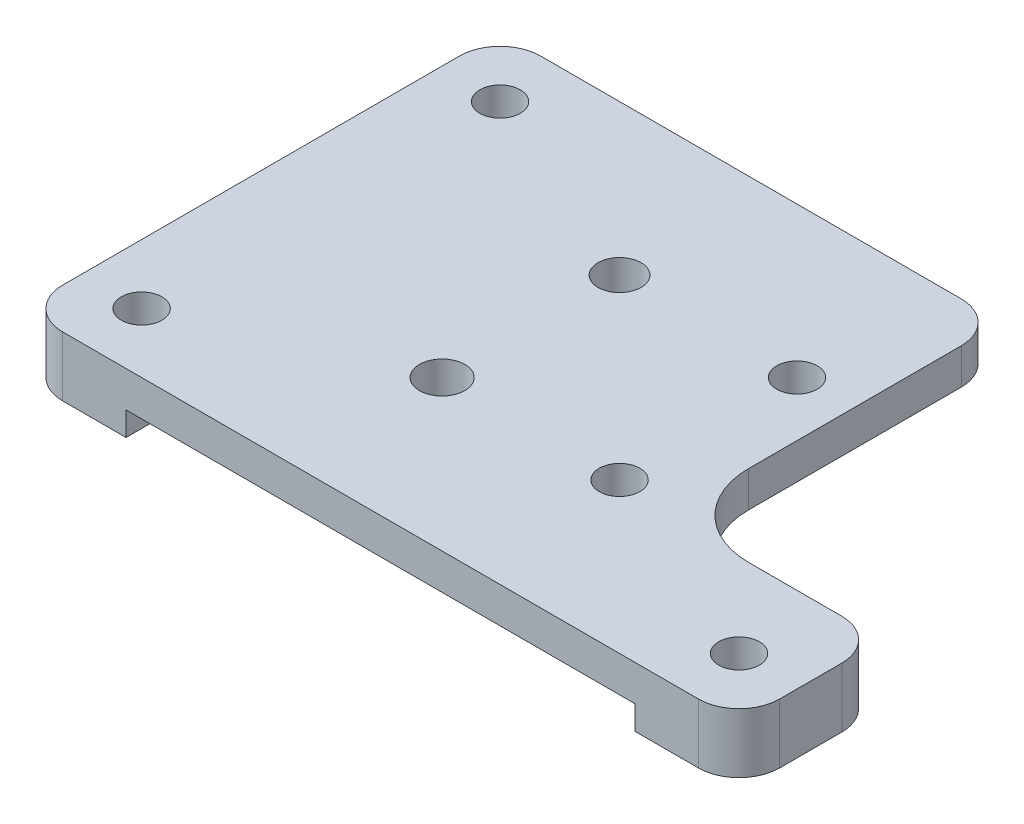
from build123d import *

# Parameters (mm, degrees)
SKETCH_2_W          = 24
SKETCH_2_H          = 5
SKETCH_2_R          = 1.7
EXTRUDE_1_DEPTH     = 3
FILLET_2_R          = 6.8
EXTRUDE_START       = 2
SKETCH_4_W          = 8.7
SKETCH_4_H          = 40
SKETCH_4_R          = 1.7
SKETCH_4_H_2        = 12
EXTRUDE_2_DEPTH     = 2
FILLET_3_R          = 3.4
SKETCH_5_R          = 1.9
SKETCH_5_R_2        = 1.8
CUT_EXTRUDE_1_DEPTH = 10


with BuildPart() as part:
    # 草图2 → 凸台-拉伸1 (new body)
    # profile 1 of 7: a face of its own
    with BuildSketch(Plane(origin=(0, 0, 0), x_dir=(1, 0, 0), z_dir=(0, 1, 0))):
        with BuildLine():
            Line((25, -8), (12, -8))
            Line((12, -8), (12, -15))
            Line((12, -15), (23.3, -15))
            ThreePointArc((23.3, -15), (23.797918472, -13.797918472), (25, -13.3))
            Line((25, -13.3), (25, -8))
        make_face()
    # profile 2 of 7: a face of its own
    with BuildSketch(Plane(origin=(0, 0, 0), x_dir=(1, 0, 0), z_dir=(0, 1, 0))):
        with BuildLine():
            Line((23.3, -15), (12, -15))
            Line((12, -15), (12, -20))
            Line((12, -20), (30, -20))
            Line((30, -20), (30, -8))
            Line((30, -8), (25, -8))
            Line((25, -8), (25, -13.3))
            ThreePointArc((25, -13.3), (26.202081528, -13.797918472), (26.7, -15))
            ThreePointArc((26.7, -15), (25, -16.7), (23.3, -15))
        make_face()
    # profile 3 of 7: a face of its own
    with BuildSketch(Plane(origin=(0, 0, 0), x_dir=(1, 0, 0), z_dir=(0, 1, 0))):
        with Locations((0, -17.5)):
            Rectangle(SKETCH_2_W, SKETCH_2_H)
    # profile 4 of 7: a face of its own
    with BuildSketch(Plane(origin=(0, 0, 0), x_dir=(1, 0, 0), z_dir=(0, 1, 0))):
        Polygon((12, 15), (-12, 15), (-12, -15), (12, -15), (12, -8), align=None)
        with Locations(Location((-7.425, -7.425, 0), (0, 0, 270))):
            Circle(SKETCH_2_R, mode=Mode.SUBTRACT)
        with Locations(Location((7.425, -7.425, 0), (0, 0, 270))):
            Circle(SKETCH_2_R, mode=Mode.SUBTRACT)
        with Locations(Location((-7.425, 7.425, 0), (0, 0, 270))):
            Circle(SKETCH_2_R, mode=Mode.SUBTRACT)
        with Locations(Location((7.425, 7.425, 0), (0, 0, 270))):
            Circle(SKETCH_2_R, mode=Mode.SUBTRACT)
    # profile 5 of 7: a face of its own
    with BuildSketch(Plane(origin=(0, 0, 0), x_dir=(1, 0, 0), z_dir=(0, 1, 0))):
        with Locations((0, 17.5)):
            Rectangle(SKETCH_2_W, SKETCH_2_H)
    # profile 6 of 7: a face of its own
    with BuildSketch(Plane(origin=(0, 0, 0), x_dir=(1, 0, 0), z_dir=(0, 1, 0))):
        with BuildLine():
            Line((-12, 15), (-23.3, 15))
            ThreePointArc((-23.3, 15), (-23.797918472, 13.797918472), (-25, 13.3))
            Line((-25, 13.3), (-25, -13.3))
            ThreePointArc((-25, -13.3), (-23.797918472, -13.797918472), (-23.3, -15))
            Line((-23.3, -15), (-12, -15))
            Line((-12, -15), (-12, 15))
        make_face()
    # profile 7 of 7: a face of its own
    with BuildSketch(Plane(origin=(0, 0, 0), x_dir=(1, 0, 0), z_dir=(0, 1, 0))):
        with BuildLine():
            ThreePointArc((-25, 13.3), (-26.202081528, 16.202081528), (-23.3, 15))
            Line((-23.3, 15), (-12, 15))
            Line((-12, 15), (-12, 20))
            Line((-12, 20), (-30, 20))
            Line((-30, 20), (-30, -20))
            Line((-30, -20), (-12, -20))
            Line((-12, -20), (-12, -15))
            Line((-12, -15), (-23.3, -15))
            ThreePointArc((-23.3, -15), (-26.202081528, -16.202081528), (-25, -13.3))
            Line((-25, -13.3), (-25, 13.3))
        make_face()
    extrude(amount=EXTRUDE_1_DEPTH)

    # 圆角2
    fillet_2_edges = [part.edges().sort_by_distance(p)[0] for p in [
        (12, 1.5, 8),
    ]]
    fillet(fillet_2_edges, radius=FILLET_2_R)

    # 草图4 → 凸台-拉伸2 (add)
    # profile 1 of 2: a face of its own
    with BuildSketch(Plane.XZ.offset(EXTRUDE_START)):
        with Locations((-25.65, 0)):
            Rectangle(SKETCH_4_W, SKETCH_4_H)
        with Locations(Location((-25, 15, 0), (0, 0, 270))):
            Circle(SKETCH_4_R, mode=Mode.SUBTRACT)
        with Locations(Location((-25, -15, 0), (0, 0, 270))):
            Circle(SKETCH_4_R, mode=Mode.SUBTRACT)
    # profile 2 of 2: a face of its own
    with BuildSketch(Plane.XZ.offset(EXTRUDE_START)):
        with Locations((25.65, 14)):
            Rectangle(SKETCH_4_W, SKETCH_4_H_2)
        with Locations(Location((25, 15, 0), (0, 0, 270))):
            Circle(SKETCH_4_R, mode=Mode.SUBTRACT)
    extrude(amount=-EXTRUDE_2_DEPTH)

    # 圆角3
    fillet_3_edges = [part.edges().sort_by_distance(p)[0] for p in [
        (12, 1.5, -20),
        (30, 0.5, 8),
        (30, 0.5, 20),
        (-30, 0.5, 20),
        (-30, 0.5, -20),
    ]]
    fillet(fillet_3_edges, radius=FILLET_3_R)

    # 草图5 → 切除-拉伸1 (cut)
    with BuildSketch(Plane(origin=(0, 3, 0), x_dir=(1, 0, 0), z_dir=(0, 1, 0))):
        with Locations(Location((-7.425, -7.425, 0), (0, 0, 270))):
            Circle(SKETCH_5_R)
        with Locations(Location((-7.425, 7.425, 0), (0, 0, 270))):
            Circle(SKETCH_5_R_2)
    extrude(amount=-CUT_EXTRUDE_1_DEPTH, mode=Mode.SUBTRACT)


solid = part.part
